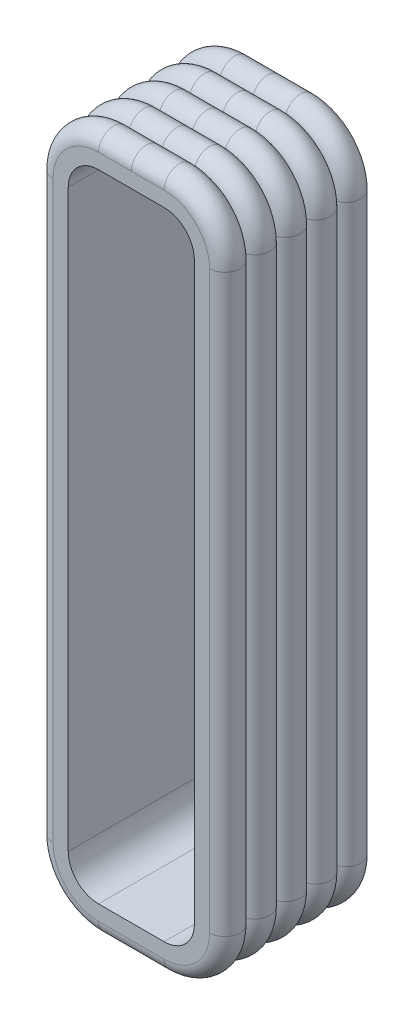
from build123d import *

# Parameters (mm, degrees)
BOSS_EXTRUDE1_DEPTH = 1.5
LPATTERN1_COUNT     = 5
LPATTERN1_PITCH     = 0.3


with BuildPart() as part:
    # Sketch1 → Boss-Extrude1 (new body)
    with BuildSketch(Plane.XY):
        with BuildLine():
            Line((-0.925, 2.85), (-0.925, -2.85))
            ThreePointArc((-0.925, -2.85), (-0.749264069, -3.274264069), (-0.325, -3.45))
            Line((-0.325, -3.45), (0.325, -3.45))
            ThreePointArc((0.325, -3.45), (0.749264069, -3.274264069), (0.925, -2.85))
            Line((0.925, -2.85), (0.925, 2.85))
            ThreePointArc((0.925, 2.85), (0.749264069, 3.274264069), (0.325, 3.45))
            Line((0.325, 3.45), (-0.325, 3.45))
            ThreePointArc((-0.325, 3.45), (-0.749264069, 3.274264069), (-0.925, 2.85))
        make_face()
        with BuildLine():
            Line((-0.325, 3.15), (0.325, 3.15))
            ThreePointArc((0.325, 3.15), (0.537132034, 3.062132034), (0.625, 2.85))
            Line((0.625, 2.85), (0.625, -2.85))
            ThreePointArc((0.625, -2.85), (0.537132034, -3.062132034), (0.325, -3.15))
            Line((0.325, -3.15), (-0.325, -3.15))
            ThreePointArc((-0.325, -3.15), (-0.537132034, -3.062132034), (-0.625, -2.85))
            Line((-0.625, -2.85), (-0.625, 2.85))
            ThreePointArc((-0.625, 2.85), (-0.537132034, 3.062132034), (-0.325, 3.15))
        make_face(mode=Mode.SUBTRACT)
    extrude(amount=-BOSS_EXTRUDE1_DEPTH)

    # Cut-Sweep3: sweep along a path in Sketch3
    with BuildLine(Plane.XY) as cut_sweep3_path:
        Line((0.325, 3.45), (-0.325, 3.45))
        ThreePointArc((-0.325, 3.45), (-0.749264069, 3.274264069), (-0.925, 2.85))
        Line((-0.925, 2.85), (-0.925, -2.85))
        ThreePointArc((-0.925, -2.85), (-0.749264069, -3.274264069), (-0.325, -3.45))
        Line((-0.325, -3.45), (0.325, -3.45))
        ThreePointArc((0.325, -3.45), (0.749264069, -3.274264069), (0.925, -2.85))
        Line((0.925, -2.85), (0.925, 2.85))
        ThreePointArc((0.925, 2.85), (0.749264069, 3.274264069), (0.325, 3.45))
    # Sketch2 → Cut-Sweep3 (sweep, cut)
    with BuildSketch(Plane(origin=(0, 0, 0), x_dir=(0, 0, -1), z_dir=(1, 0, 0))):
        with BuildLine():
            Line((0.3, 3.45), (0.3, 3.3))
            ThreePointArc((0.3, 3.3), (0.15, 3.45), (0, 3.3))
            Line((0, 3.3), (0, 3.45))
            Line((0, 3.45), (0, 3.95))
            Line((0, 3.95), (0.3, 3.95))
            Line((0.3, 3.95), (0.3, 3.45))
        make_face()
    cut_sweep3 = sweep(path=cut_sweep3_path.line, mode=Mode.SUBTRACT)

    # LPattern1: Cut-Sweep3 ×5
    with Locations(*[(0, 0, -i * LPATTERN1_PITCH) for i in range(1, LPATTERN1_COUNT)]):
        add(cut_sweep3, mode=Mode.SUBTRACT)


solid = part.part
